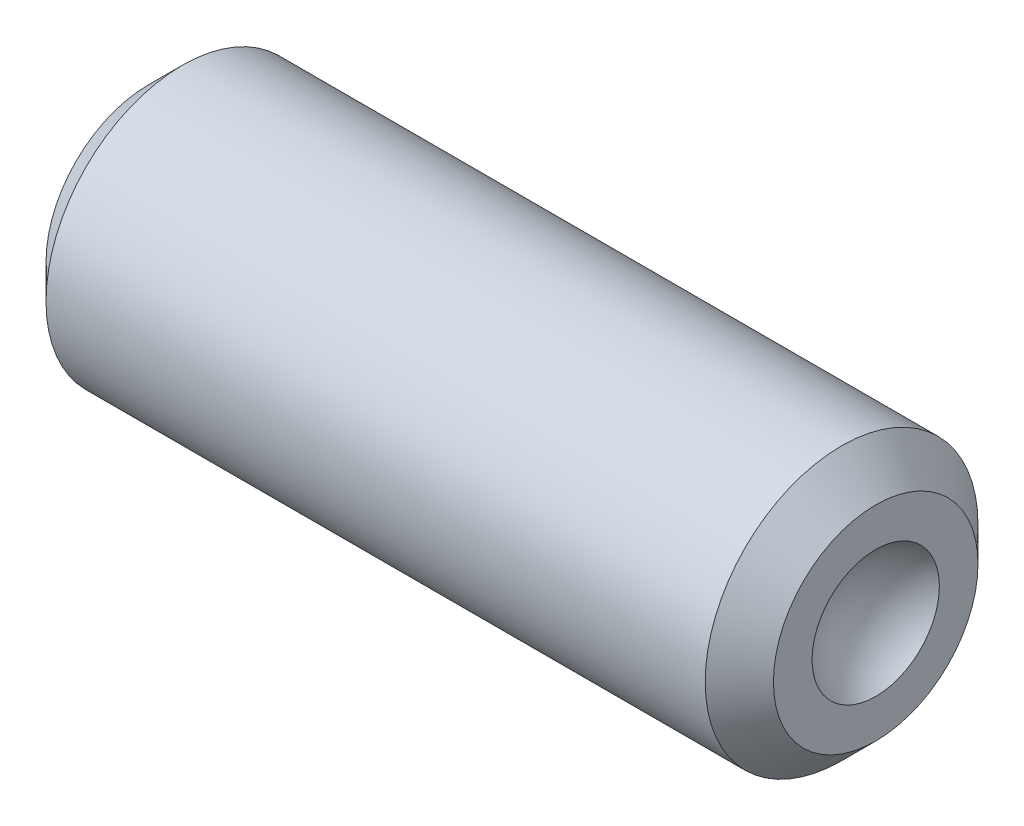
from build123d import *

# Parameters (mm, degrees)
CUT_EXTRUDE1_DEPTH = 6


with BuildPart() as part:
    # Sketch1 → Revolve1 (revolve)
    with BuildSketch(Plane.XY, mode=Mode.PRIVATE) as revolve1_sk:
        with BuildLine():
            Line((0, 0), (0, 1.125))
            Line((0, 1.125), (0.375, 1.5))
            Line((0.375, 1.5), (7.625, 1.5))
            Line((7.625, 1.5), (8, 1.125))
            Line((8, 1.125), (8, 0.7))
            ThreePointArc((8, 0.7), (7.724655592, 0.397059504), (7.625, 0))
            Line((7.625, 0), (0, 0))
        make_face()
    revolve(revolve1_sk.sketch.rotate(Axis((0, 0, 0), (1, 0, 0)), 180), axis=Axis((0, 0, 0), (1, 0, 0)))

    # Sketch2 → Cut-Extrude1 (cut)
    with BuildSketch(Plane.ZY):
        Polygon((0, 0.866025404), (-0.75, 0.433012702), (-0.75, -0.433012702), (0, -0.866025404), (0.75, -0.433012702), (0.75, 0.433012702), align=None)
    extrude(amount=-CUT_EXTRUDE1_DEPTH, mode=Mode.SUBTRACT)


solid = part.part
